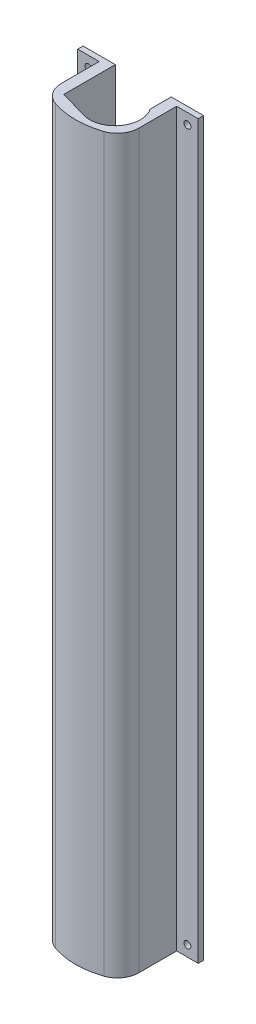
from build123d import *

# Parameters (mm, degrees)
BOSS_EXTRUDE1_DEPTH = 431.8
SKETCH2_R           = 2.032
CUT_EXTRUDE1_DEPTH  = 436.166892099
FILLET2_R           = 12.7
SCALE1_SCALE        = 0.25


with BuildPart() as part:
    # Sketch1 → Boss-Extrude1 (new body)
    with BuildSketch(Plane(origin=(0, 0, 0), x_dir=(1, 0, 0), z_dir=(0, 1, 0))):
        with BuildLine():
            Line((-20.574, -9.652129604), (-4.162019583, -14.39674322))
            ThreePointArc((-4.162019583, -14.39674322), (12.103082443, -8.837647749), (12.446, 8.347796497))
            Line((12.446, 8.347796497), (12.446, 20.746712887))
            Line((12.446, 20.746712887), (31.496, 20.746712887))
            Line((31.496, 20.746712887), (31.496, 17.571712887))
            Line((31.496, 17.571712887), (18.796, 17.571712887))
            Line((18.796, 17.571712887), (18.796, -12.827129604))
            ThreePointArc((18.796, -12.827129604), (-4.064, -19.155968814), (-26.924, -12.827129604))
            Line((-26.924, -12.827129604), (-26.924, 17.571712887))
            Line((-26.924, 17.571712887), (-39.624, 17.571712887))
            Line((-39.624, 17.571712887), (-39.624, 20.746712887))
            Line((-39.624, 20.746712887), (-20.574, 20.746712887))
            Line((-20.574, 20.746712887), (-20.574, 9.652))
            Line((-20.574, 9.652), (-20.574, -9.652129604))
        make_face()
    extrude(amount=BOSS_EXTRUDE1_DEPTH)

    # Sketch2 → Cut-Extrude1 (cut, through all)
    with BuildSketch(Plane.XY.offset(-17.571712887)):
        with Locations((-33.274, 425.45)):
            Circle(SKETCH2_R)
        with Locations((-33.274, 6.35)):
            Circle(SKETCH2_R)
        with Locations((25.146, 425.45)):
            Circle(SKETCH2_R)
        with Locations((25.146, 6.35)):
            Circle(SKETCH2_R)
    extrude(amount=-CUT_EXTRUDE1_DEPTH, mode=Mode.SUBTRACT)

    # Fillet2
    fillet2_edges = [part.edges().sort_by_distance(p)[0] for p in [
        (18.796, 215.9, 12.827129604),
        (-26.924, 215.9, 12.827129604),
    ]]
    fillet(fillet2_edges, radius=FILLET2_R)


with BuildPart() as part_1:
    # Scale1: scaled about (-5.110319003, 215.9, -0.816697422)
    add(part.part.scale(SCALE1_SCALE).moved(Location((-3.832739252, 161.925, -0.612523066))))


solid = part_1.part
